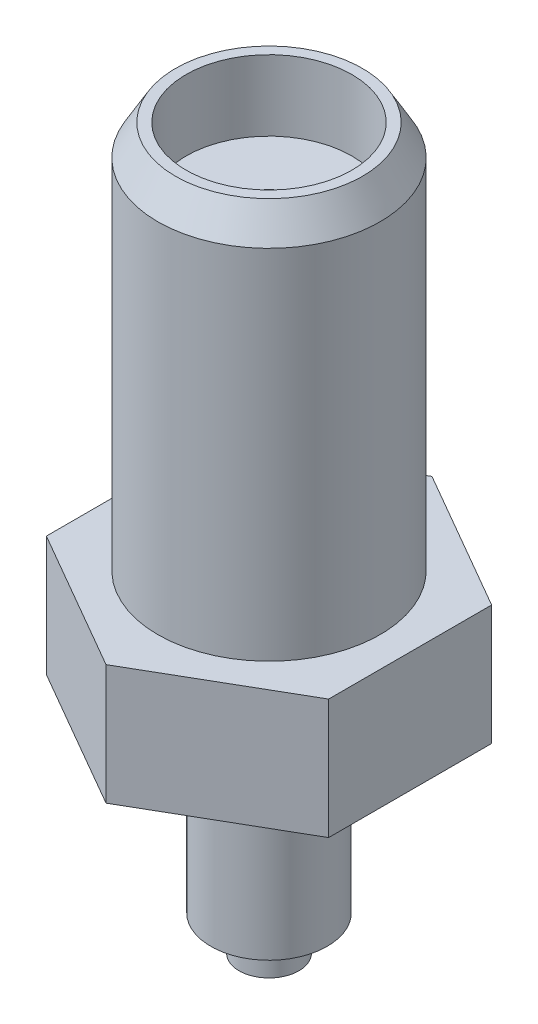
from build123d import *

# Parameters (mm, degrees)
CHAMFER_1_SIZE      = 0.5
CHAMFER_1_SIZE2     = 0.866025404
CUT_EXTRUDE_1_REACH = 15.077
SKETCH_2_R          = 5


with BuildPart() as part:
    # Эскиз1 → Повернуть1 (revolve)
    with BuildSketch(Plane.XY, mode=Mode.PRIVATE) as revolve_1_sk:
        Polygon((2.35, 11), (2.35, 9), (0.5, 9), (0.5, 4), (0, 4), (0, -9.4), (0.85, -9.4), (0.85, -8.4), (1.65, -8.4), (1.65, -3.4), (5, -3.4), (5, 0), (3.15, 0), (3.15, 11), align=None)
    revolve(revolve_1_sk.sketch.rotate(Axis((0, 0, 0), (0, 1, 0)), 90), axis=Axis((0, 0, 0), (0, 1, 0)))

    # Фаска1
    chamfer_1_edges = [part.edges().sort_by_distance(p)[0] for p in [
        (0, 11, 3.15),
    ]]
    chamfer_1_side = [part.faces().sort_by_distance(p)[0] for p in [
        (0, 11, 3.060904546),
    ]]
    chamfer(chamfer_1_edges, length=CHAMFER_1_SIZE, length2=CHAMFER_1_SIZE2, reference=chamfer_1_side[0])

    # Эскиз2 → Вырез-Вытянуть1 (cut, up to next)
    with BuildSketch(Plane(origin=(0, 0, 0), x_dir=(1, 0, 0), z_dir=(0, 1, 0)), mode=Mode.PRIVATE) as cut_extrude_1_sk1:
        Circle(SKETCH_2_R)
        Polygon((-4, 2.309401077), (-4, -2.309401077), (0, -4.618802154), (4, -2.309401077), (4, 2.309401077), (0, 4.618802154), align=None, mode=Mode.SUBTRACT)
    cut_extrude_1_tool1 = extrude(cut_extrude_1_sk1.sketch, amount=-CUT_EXTRUDE_1_REACH, mode=Mode.PRIVATE) & part.part
    add(cut_extrude_1_tool1.solids().sort_by_distance((-4.858579, 0, 0))[0], mode=Mode.SUBTRACT)


solid = part.part
